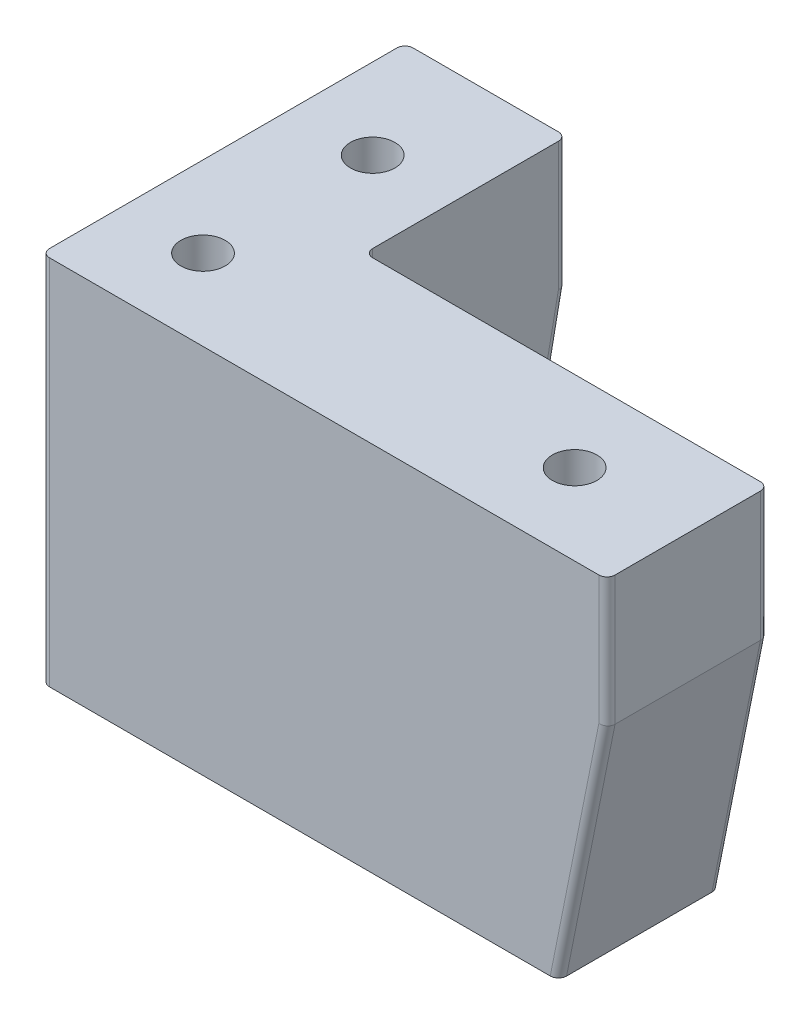
from build123d import *

# Parameters (mm, degrees)
BOSS_EXTRUDE1_DEPTH  = 16
SKETCH6_R            = 5.2
CUT_EXTRUDE2_DEPTH   = 41
M5_CLEARANCE_HOLE1_D = 5.5
FILLET2_R            = 1
SKETCH12_W           = 0.542735043
SKETCH12_H           = 2.03525641
BRF_PART_NUM_DEPTH   = 0.4


with BuildPart() as part:
    # Sketch1 → Boss-Extrude1 (new body)
    with BuildSketch(Plane(origin=(0, 0, 0), x_dir=(1, 0, 0), z_dir=(0, 1, 0))):
        Polygon((0, 0), (70, 0), (70, 20), (20, 20), (20, 45), (0, 45), align=None)
    extrude(amount=-BOSS_EXTRUDE1_DEPTH)

    # Sketch5 → section 1 of loft1
    with BuildSketch(Plane(origin=(0, -46, 0), x_dir=(1, 0, 0), z_dir=(0, 1, 0)), mode=Mode.PRIVATE) as loft1_s1:
        with BuildLine():
            Line((0, 0), (64, 0))
            Line((64, 0), (64, 20))
            Line((64, 20), (20, 20))
            Line((20, 20), (20, 39))
            Line((20, 39), (0, 39))
            Line((0, 39), (0, 0))
        make_face()
    # loft from a face of the part (loft1)
    loft([part.faces().sort_by_distance((28.421052632, -16, -15.921052632))[0], loft1_s1.sketch])

    # Sketch6 → Cut-Extrude2 (cut)
    with BuildSketch(Plane.XZ.offset(46)):
        with Locations(Location((56, -10, 0), (0, 0, 270))):
            Circle(SKETCH6_R)
        with Locations(Location((10, -10, 0), (0, 0, 270))):
            Circle(SKETCH6_R)
        with Locations(Location((10, -31, 0), (0, 0, 270))):
            Circle(SKETCH6_R)
    extrude(amount=-CUT_EXTRUDE2_DEPTH, mode=Mode.SUBTRACT)

    # M5 Clearance Hole1 (through all)
    with Locations(Plane(origin=(0, -5, 0), x_dir=(-1, 0, 0), z_dir=(0, -1, 0))):
        with Locations((-10, 10), (-56, 10), (-10, 31)):
            Hole(M5_CLEARANCE_HOLE1_D / 2)

    # Fillet2
    fillet2_edges = [part.edges().sort_by_distance(p)[0] for p in [
        (67, -31, 0),
        (67, -31, -20),
        (20, -23, -20),
        (20, -31, -42),
        (0, -31, -42),
        (0, -23, 0),
        (0, -8, -45),
        (20, -8, -45),
        (70, -8, -20),
        (70, -8, 0),
    ]]
    fillet(fillet2_edges, radius=FILLET2_R)

    # Sketch12 → BRF Part Num (cut)
    # profile 1 of 6: a face of its own
    with BuildSketch(Plane(origin=(0, -40, 0), x_dir=(0, -1, 0), z_dir=(1, 0, 0))):
        with BuildLine():
            Line((-37.291666667, 11.645299145), (-36.748931624, 11.645299145))
            Line((-36.748931624, 11.645299145), (-36.748931624, 13.445229033))
            Line((-36.748931624, 13.445229033), (-35.357113048, 13.730376936))
            add(Edge.make_bspline(
                [(-35.357113048, 13.730376936), (-35.372580244, 13.674351984), (-35.402545491, 13.565812498), (-35.435816121, 13.40561128), (-35.455872209, 13.253525448), (-35.458610738, 13.154835305), (-35.459935897, 13.107079661)],
                knots=[0, 0, 0, 0, 1.100273476, 2.13160584, 3.095893838, 4, 4, 4, 4], degree=3))
            add(Edge.make_bspline(
                [(-35.459935897, 13.107079661), (-35.458699161, 13.047977922), (-35.456267429, 12.931769136), (-35.431530908, 12.762005961), (-35.395702072, 12.599132488), (-35.340500968, 12.445553532), (-35.273090574, 12.298839318), (-35.188185711, 12.161509484), (-35.089059493, 12.031636602), (-34.97622244, 11.910118285), (-34.850748527, 11.800394824), (-34.715281067, 11.705048752), (-34.572776189, 11.621829319), (-34.41989387, 11.556925628), (-34.259517522, 11.503957886), (-34.08979586, 11.469030825), (-33.912235633, 11.445701061), (-33.790821361, 11.443099919), (-33.728907919, 11.441773504)],
                knots=[0, 0, 0, 0, 1.052805225, 2.070078116, 3.052532748, 4.020689046, 4.973125432, 5.925915817, 6.89216474, 7.881560752, 8.877013184, 9.857446635, 10.830895175, 11.812622661, 12.812548702, 13.836681939, 14.896847428, 16, 16, 16, 16], degree=3))
            add(Edge.make_bspline(
                [(-33.728907919, 11.441773504), (-33.685785308, 11.442779941), (-33.60012285, 11.444779212), (-33.472900882, 11.454923797), (-33.348390818, 11.474530771), (-33.226820927, 11.50053571), (-33.108077349, 11.53525102), (-32.991495245, 11.575856884), (-32.878351179, 11.626327286), (-32.768145441, 11.682279364), (-32.662139298, 11.744235746), (-32.562874439, 11.813904321), (-32.468085619, 11.886293984), (-32.380587921, 11.965393056), (-32.300041956, 12.050302222), (-32.226049525, 12.14054904), (-32.157282686, 12.235314957), (-32.096553125, 12.336092527), (-32.040668405, 12.440629054), (-31.994822172, 12.550436088), (-31.953833617, 12.663013552), (-31.921162075, 12.779981882), (-31.895561663, 12.901076097), (-31.878173851, 13.026495818), (-31.865509475, 13.155583259), (-31.864716697, 13.243084766), (-31.864316239, 13.287284655)],
                knots=[0, 0, 0, 0, 1.056393913, 2.098511576, 3.122979385, 4.141471433, 5.141222888, 6.151259816, 7.162667642, 8.172852865, 9.177685681, 10.166741883, 11.141342384, 12.097242845, 13.052202613, 14.005160326, 14.953864445, 15.917140761, 16.884916217, 17.854238259, 18.828761908, 19.81781811, 20.826036654, 21.857789401, 22.917898972, 24, 24, 24, 24], degree=3))
            add(Edge.make_bspline(
                [(-31.864316239, 13.287284655), (-31.86536353, 13.340009751), (-31.867423949, 13.443740147), (-31.888880904, 13.595736837), (-31.919815429, 13.741890122), (-31.965646605, 13.88157361), (-32.025659266, 14.014204742), (-32.096963386, 14.141682766), (-32.181849849, 14.262427648), (-32.279542228, 14.37561389), (-32.38688557, 14.479657137), (-32.502258635, 14.57400432), (-32.625808355, 14.656952914), (-32.757132984, 14.728803812), (-32.895999586, 14.790014228), (-33.042836041, 14.838120628), (-33.196900313, 14.876942439), (-33.302965578, 14.893367092), (-33.356837607, 14.901709402)],
                knots=[0, 0, 0, 0, 1.046872515, 2.059598001, 3.044168548, 4.012104806, 4.973680974, 5.932408326, 6.910122221, 7.900780896, 8.89867654, 9.876692837, 10.858029398, 11.85084981, 12.847361615, 13.868568023, 14.917415949, 16, 16, 16, 16], degree=3))
            Line((-33.356837607, 14.901709402), (-33.356837607, 14.426816239))
            add(Edge.make_bspline(
                [(-33.356837607, 14.426816239), (-33.306370336, 14.415138707), (-33.209369438, 14.392693841), (-33.073169351, 14.343299774), (-32.951755568, 14.283493409), (-32.844385746, 14.21071948), (-32.749094503, 14.12636518), (-32.665076427, 14.028307665), (-32.589185163, 13.918998341), (-32.525817449, 13.79746784), (-32.472438695, 13.669004222), (-32.434345863, 13.535316918), (-32.411287453, 13.39832995), (-32.408468654, 13.3060998), (-32.407051282, 13.259723892)],
                knots=[0, 0, 0, 0, 1.13623081, 2.183898708, 3.172478118, 4.09966615, 5.022692284, 5.957376522, 6.927682873, 7.937366477, 8.960015386, 9.976409503, 10.982481913, 12, 12, 12, 12], degree=3))
            add(Edge.make_bspline(
                [(-32.407051282, 13.259723892), (-32.408302603, 13.214433419), (-32.410766465, 13.125256108), (-32.429424138, 12.993950447), (-32.458913883, 12.867550289), (-32.500227327, 12.745831257), (-32.554882591, 12.629391456), (-32.622023433, 12.518395518), (-32.69997475, 12.411262209), (-32.789070259, 12.310811116), (-32.887309327, 12.218832512), (-32.992349634, 12.137557109), (-33.104408005, 12.069859012), (-33.221539833, 12.012808546), (-33.345030087, 11.96948751), (-33.474299706, 11.938582687), (-33.609668073, 11.920435207), (-33.701999052, 11.91793878), (-33.749048478, 11.916666667)],
                knots=[0, 0, 0, 0, 1.027268864, 2.022700798, 3.002744649, 3.968653148, 4.933396556, 5.915045722, 6.907600446, 7.935526002, 8.956456544, 9.95700807, 10.942805781, 11.92166854, 12.907987664, 13.905483474, 14.932689774, 16, 16, 16, 16], degree=3))
            add(Edge.make_bspline(
                [(-33.749048478, 11.916666667), (-33.791501358, 11.917631976), (-33.874246411, 11.919513463), (-33.995728944, 11.935801371), (-34.110858651, 11.963010064), (-34.22013648, 12.001749716), (-34.323213045, 12.050098039), (-34.419861193, 12.110800826), (-34.510989671, 12.181273297), (-34.594253359, 12.26354831), (-34.671222884, 12.353046493), (-34.736599449, 12.452066616), (-34.792196897, 12.55796521), (-34.837749179, 12.67093852), (-34.87403506, 12.791125705), (-34.899112726, 12.918591497), (-34.914118823, 13.053364947), (-34.916154476, 13.145554314), (-34.917200855, 13.192942041)],
                knots=[0, 0, 0, 0, 1.045723156, 2.038222538, 3.013889863, 3.95567481, 4.890389958, 5.81331128, 6.76251276, 7.723027653, 8.692928204, 9.666105983, 10.639751036, 11.635719707, 12.66315958, 13.728667616, 14.832476222, 16, 16, 16, 16], degree=3))
            add(Edge.make_bspline(
                [(-34.917200855, 13.192942041), (-34.916323056, 13.233958397), (-34.914510625, 13.318646768), (-34.901165802, 13.448553899), (-34.879637345, 13.585066385), (-34.850024804, 13.72766092), (-34.811273057, 13.876765735), (-34.764835658, 14.032066175), (-34.709315493, 14.193888768), (-34.667387027, 14.302923899), (-34.645833333, 14.358974359)],
                knots=[0, 0, 0, 0, 0.817624296, 1.688186739, 2.600797293, 3.572016777, 4.590301741, 5.671205678, 6.80286297, 8, 8, 8, 8], degree=3))
            Line((-34.645833333, 14.358974359), (-37.291666667, 13.816239316))
            Line((-37.291666667, 13.816239316), (-37.291666667, 11.645299145))
        make_face()
    # profile 2 of 6: a face of its own
    with BuildSketch(Plane(origin=(0, -40, 0), x_dir=(0, -1, 0), z_dir=(1, 0, 0))):
        with BuildLine():
            add(Edge.make_bspline(
                [(-34.643713275, 19.040064103), (-34.728527182, 19.03956817), (-34.89327942, 19.038604815), (-35.133346677, 19.027887797), (-35.358560447, 19.010084602), (-35.56893151, 18.98568643), (-35.764514182, 18.955995677), (-35.944785767, 18.916360347), (-36.110580689, 18.871286267), (-36.262439362, 18.81904613), (-36.40240851, 18.760100752), (-36.533073498, 18.695942621), (-36.654246443, 18.624034748), (-36.767826261, 18.548454517), (-36.872078268, 18.466259599), (-36.968203643, 18.379212409), (-37.055391743, 18.285571991), (-37.133702276, 18.186246573), (-37.202369187, 18.081909328), (-37.263225844, 17.975411402), (-37.313353149, 17.864849915), (-37.354358664, 17.751680348), (-37.387832412, 17.63566418), (-37.410825447, 17.51683103), (-37.425266903, 17.394905434), (-37.42664933, 17.312610771), (-37.427350427, 17.270875067)],
                knots=[0, 0, 0, 0, 1.646148282, 3.197666765, 4.66315463, 6.030252048, 7.307778049, 8.501004361, 9.610818041, 10.641065266, 11.615491391, 12.557119604, 13.464013759, 14.348536654, 15.203310953, 16.038349431, 16.863300206, 17.683791446, 18.490318933, 19.285717724, 20.06220424, 20.843281102, 21.620494212, 22.403315558, 23.190242141, 24, 24, 24, 24], degree=3))
            add(Edge.make_bspline(
                [(-37.427350427, 17.270875067), (-37.426766454, 17.228770065), (-37.425604553, 17.14499593), (-37.4092501, 17.021586479), (-37.388140934, 16.900326611), (-37.354285307, 16.783056077), (-37.313772659, 16.667557516), (-37.260316864, 16.556703146), (-37.202179536, 16.446579221), (-37.131256885, 16.342188524), (-37.052875685, 16.240412052), (-36.963892985, 16.145007235), (-36.866771391, 16.053535272), (-36.759344807, 15.969451023), (-36.6432604, 15.889150754), (-36.517545051, 15.815682744), (-36.38247736, 15.747518993), (-36.238683482, 15.683378202), (-36.08232246, 15.627288775), (-35.914369559, 15.57742079), (-35.733303883, 15.536545539), (-35.540134084, 15.502742425), (-35.333903201, 15.476504773), (-35.115029082, 15.457409454), (-34.883374796, 15.447319238), (-34.724990856, 15.445419387), (-34.643713275, 15.444444444)],
                knots=[0, 0, 0, 0, 0.810910589, 1.61342667, 2.396193133, 3.181089899, 3.963115317, 4.752255436, 5.550715454, 6.36105385, 7.181178335, 8.024612154, 8.872680183, 9.750181803, 10.651284446, 11.591556747, 12.554036451, 13.566402641, 14.62422919, 15.753422176, 16.94128843, 18.199818041, 19.531985927, 20.947085226, 22.433341622, 24, 24, 24, 24], degree=3))
            add(Edge.make_bspline(
                [(-34.643713275, 15.444444444), (-34.562790932, 15.445440836), (-34.404764101, 15.447386612), (-34.174141282, 15.457193047), (-33.956446942, 15.476971184), (-33.751448986, 15.501350226), (-33.55905237, 15.535531154), (-33.379382459, 15.576716347), (-33.21180314, 15.623640748), (-33.057515097, 15.680590997), (-32.913970745, 15.743238859), (-32.779896199, 15.811329465), (-32.654214049, 15.884382884), (-32.537823452, 15.963478835), (-32.43082806, 16.048946185), (-32.333373356, 16.140354033), (-32.243824688, 16.236591846), (-32.164579961, 16.338961657), (-32.093117341, 16.444324689), (-32.032870241, 16.554459802), (-31.980669665, 16.666548342), (-31.937990878, 16.781709405), (-31.904892981, 16.89976519), (-31.882139979, 17.02110817), (-31.866146366, 17.145013345), (-31.864928394, 17.22877589), (-31.864316239, 17.270875067)],
                knots=[0, 0, 0, 0, 1.561645053, 3.049612875, 4.452756685, 5.778837748, 7.032101753, 8.221335837, 9.334924186, 10.387562255, 11.392109817, 12.355697819, 13.287721948, 14.19548756, 15.068665045, 15.927346723, 16.771751757, 17.602390507, 18.423119567, 19.225778204, 20.022010933, 20.807278863, 21.593079439, 22.384715467, 23.188155646, 24, 24, 24, 24], degree=3))
            add(Edge.make_bspline(
                [(-31.864316239, 17.270875067), (-31.865021324, 17.312609858), (-31.866411614, 17.394902721), (-31.88079547, 17.516841507), (-31.903920815, 17.635197105), (-31.936300678, 17.750553559), (-31.975935026, 17.863502677), (-32.027572097, 17.972505464), (-32.087041637, 18.07877349), (-32.154767385, 18.1820248), (-32.232363413, 18.280313248), (-32.318175969, 18.374214704), (-32.414405575, 18.461283359), (-32.5195372, 18.542765573), (-32.633286004, 18.619144823), (-32.755728325, 18.690431317), (-32.887073233, 18.755934893), (-33.028148569, 18.815887343), (-33.181085066, 18.869041879), (-33.347302615, 18.915812681), (-33.528489491, 18.953167085), (-33.723725774, 18.984830716), (-33.933408166, 19.010203198), (-34.157612531, 19.027880405), (-34.395913121, 19.038596679), (-34.559605914, 19.039566035), (-34.643713275, 19.040064103)],
                knots=[0, 0, 0, 0, 0.810927267, 1.598990287, 2.382942141, 3.152806972, 3.926217614, 4.706701772, 5.493896336, 6.292070767, 7.104102563, 7.925577746, 8.761822141, 9.623241997, 10.509042271, 11.423174113, 12.375371989, 13.360203808, 14.400680605, 15.520553799, 16.714061498, 17.994519714, 19.364400916, 20.818312473, 22.365209998, 24, 24, 24, 24], degree=3))
        make_face()
        with BuildLine():
            add(Edge.make_bspline(
                [(-34.645833333, 18.56517094), (-34.575154036, 18.564986388), (-34.437979397, 18.564628207), (-34.238993342, 18.5555418), (-34.053087215, 18.542894446), (-33.880333573, 18.526983349), (-33.721336185, 18.503154217), (-33.575434041, 18.47611861), (-33.442897204, 18.44369105), (-33.322567459, 18.405134238), (-33.212740888, 18.361214277), (-33.110490223, 18.313345593), (-33.014603605, 18.261465332), (-32.925313667, 18.20451006), (-32.843711881, 18.141353732), (-32.767729828, 18.074924283), (-32.700010098, 18.002229104), (-32.618777326, 17.901686249), (-32.534839045, 17.768944231), (-32.46174395, 17.601697275), (-32.415808673, 17.429841243), (-32.409967028, 17.313195922), (-32.407051282, 17.254974626)],
                knots=[0, 0, 0, 0, 1.459098681, 2.831824031, 4.11146945, 5.306290378, 6.412266529, 7.42953815, 8.369053297, 9.227277979, 10.03601793, 10.809473603, 11.557037441, 12.285528272, 12.993193355, 13.685654407, 14.36688038, 15.041354379, 16.352855396, 17.594313975, 18.799247529, 20, 20, 20, 20], degree=3))
            add(Edge.make_bspline(
                [(-32.407051282, 17.254974626), (-32.409604366, 17.19641631), (-32.414701478, 17.079507395), (-32.459187058, 16.90780923), (-32.531506485, 16.742502876), (-32.614129716, 16.612044853), (-32.693318287, 16.513070126), (-32.760756315, 16.442130202), (-32.836289018, 16.377026127), (-32.917778456, 16.315276343), (-33.006788369, 16.258641915), (-33.102888837, 16.207141659), (-33.206347263, 16.160146608), (-33.278570555, 16.133372216), (-33.315496461, 16.11968316)],
                knots=[0, 0, 0, 0, 1.353621445, 2.702441307, 4.075953605, 5.516772412, 6.261413105, 7.007624062, 7.778524365, 8.566925914, 9.372323995, 10.217594641, 11.088702136, 12, 12, 12, 12], degree=3))
            add(Edge.make_bspline(
                [(-33.315496461, 16.11968316), (-33.362712853, 16.103729892), (-33.458582377, 16.071337916), (-33.607298851, 16.029591543), (-33.763331602, 15.99671457), (-33.925748147, 15.967136625), (-34.095746266, 15.946948076), (-34.272799966, 15.930698406), (-34.45704274, 15.92112701), (-34.582220881, 15.919940541), (-34.645833333, 15.919337607)],
                knots=[0, 0, 0, 0, 0.884706709, 1.796334032, 2.740027952, 3.714592787, 4.726048262, 5.777819803, 6.87074269, 8, 8, 8, 8], degree=3))
            add(Edge.make_bspline(
                [(-34.645833333, 15.919337607), (-34.709435497, 15.920169441), (-34.833854924, 15.921796685), (-35.016066935, 15.928016643), (-35.189131289, 15.944078475), (-35.35379355, 15.96191762), (-35.509142225, 15.988220558), (-35.656477793, 16.016580588), (-35.793975029, 16.054682379), (-35.92378639, 16.09538266), (-36.044437895, 16.141964542), (-36.156489101, 16.193243633), (-36.260491283, 16.24800143), (-36.356123103, 16.307504307), (-36.443939269, 16.370923449), (-36.521919136, 16.44053271), (-36.593855995, 16.511911388), (-36.674502526, 16.613426913), (-36.757380149, 16.745247911), (-36.831574439, 16.91040923), (-36.875484622, 17.081344076), (-36.881573992, 17.197139507), (-36.884615385, 17.254974626)],
                knots=[0, 0, 0, 0, 1.313483664, 2.569454835, 3.763100662, 4.901599063, 5.988328865, 7.015709358, 7.99797933, 8.932480776, 9.824041341, 10.666387587, 11.475829342, 12.24921787, 12.990555181, 13.709176526, 14.405678811, 15.080244297, 16.38186033, 17.610124501, 18.806354173, 20, 20, 20, 20], degree=3))
            add(Edge.make_bspline(
                [(-36.884615385, 17.254974626), (-36.881566425, 17.313510245), (-36.875462951, 17.430688121), (-36.83177751, 17.603448391), (-36.757597227, 17.769725475), (-36.674662199, 17.90198117), (-36.594165202, 18.002263452), (-36.52565299, 18.073426112), (-36.451485734, 18.140776846), (-36.369160047, 18.202297748), (-36.280184723, 18.258915291), (-36.185538085, 18.31280054), (-36.083096367, 18.360029094), (-35.973355914, 18.404090057), (-35.85301955, 18.44271118), (-35.720003149, 18.47476822), (-35.573752581, 18.503952364), (-35.413593467, 18.524969704), (-35.240802954, 18.543476868), (-35.054421404, 18.555402954), (-34.854752049, 18.564669832), (-34.716867691, 18.565000559), (-34.645833333, 18.56517094)],
                knots=[0, 0, 0, 0, 1.207546505, 2.417292871, 3.651582144, 4.952510111, 5.626719005, 6.30238548, 6.989136872, 7.692112372, 8.420316868, 9.164734959, 9.937886623, 10.746308695, 11.604196049, 12.543341915, 13.568754172, 14.680483261, 15.875568977, 17.154711427, 18.534182925, 20, 20, 20, 20], degree=3))
        make_face(mode=Mode.SUBTRACT)
    # profile 3 of 6: a face of its own
    with BuildSketch(Plane(origin=(0, -40, 0), x_dir=(0, -1, 0), z_dir=(1, 0, 0))):
        with Locations((-34.03525641, 20.46474359)):
            Rectangle(SKETCH12_W, SKETCH12_H)
    # profile 4 of 6: a face of its own
    with BuildSketch(Plane(origin=(0, -40, 0), x_dir=(0, -1, 0), z_dir=(1, 0, 0))):
        Polygon((-37.291666667, 24.53525641), (-37.291666667, 21.957264957), (-36.748931624, 21.957264957), (-36.748931624, 24.060363248), (-35.120726496, 24.060363248), (-35.120726496, 21.957264957), (-34.577991453, 21.957264957), (-34.577991453, 24.060363248), (-32, 24.060363248), (-32, 24.53525641), align=None)
    # profile 5 of 6: a face of its own
    with BuildSketch(Plane(origin=(0, -40, 0), x_dir=(0, -1, 0), z_dir=(1, 0, 0))):
        with BuildLine():
            Line((-37.291666667, 29.012820513), (-37.291666667, 27.953851162))
            add(Edge.make_bspline(
                [(-37.291666667, 27.953851162), (-37.291431435, 27.883183027), (-37.290979766, 27.74749238), (-37.288461291, 27.55310184), (-37.28124292, 27.376470396), (-37.275031133, 27.217690401), (-37.263704031, 27.076764768), (-37.252877814, 26.953261364), (-37.238705732, 26.847749012), (-37.225543962, 26.783877308), (-37.219584669, 26.754957933)],
                knots=[0, 0, 0, 0, 1.410062039, 2.707475311, 3.878576406, 4.937260626, 5.877586885, 6.699081471, 7.410979367, 8, 8, 8, 8], degree=3))
            add(Edge.make_bspline(
                [(-37.219584669, 26.754957933), (-37.210019176, 26.716243186), (-37.191092249, 26.639639583), (-37.151088227, 26.529345594), (-37.104792892, 26.424248168), (-37.050424199, 26.324774344), (-36.987548423, 26.231457523), (-36.917362949, 26.143204107), (-36.840009535, 26.060300571), (-36.754790866, 25.983828874), (-36.663522649, 25.914365722), (-36.566455374, 25.853435839), (-36.463990393, 25.801951208), (-36.355968109, 25.761548987), (-36.243581792, 25.727647085), (-36.12568437, 25.704869183), (-36.002669421, 25.690680776), (-35.918968364, 25.6892791), (-35.876527444, 25.688568376)],
                knots=[0, 0, 0, 0, 1.02737844, 2.032840108, 3.019645024, 3.985760442, 4.950801802, 5.916702504, 6.889791722, 7.870143693, 8.864820395, 9.842884691, 10.820524757, 11.815201459, 12.812418953, 13.84314332, 14.906358105, 16, 16, 16, 16], degree=3))
            add(Edge.make_bspline(
                [(-35.876527444, 25.688568376), (-35.806019607, 25.690789361), (-35.668440556, 25.695123079), (-35.46877708, 25.73552889), (-35.282526569, 25.801714819), (-35.109923533, 25.892917887), (-34.954332438, 26.009061618), (-34.817670678, 26.148647909), (-34.703310334, 26.311754631), (-34.624006689, 26.463594192), (-34.573217411, 26.597721613), (-34.537481487, 26.708141027), (-34.509871135, 26.828589909), (-34.485136174, 26.957914213), (-34.466461588, 27.096652121), (-34.452783999, 27.244471109), (-34.444235616, 27.4014766), (-34.442962585, 27.509334479), (-34.442307692, 27.564820379)],
                knots=[0, 0, 0, 0, 1.260483769, 2.459530307, 3.627416485, 4.787058657, 5.939039949, 7.08810263, 8.267026773, 9.491475466, 10.141966685, 10.831826277, 11.566392101, 12.351337768, 13.187381173, 14.07005841, 15.007169909, 16, 16, 16, 16], degree=3))
            Line((-34.442307692, 27.564820379), (-32, 25.620726496))
            Line((-32, 25.620726496), (-32, 26.207982772))
            Line((-32, 26.207982772), (-34.442307692, 28.152076656))
            Line((-34.442307692, 28.152076656), (-34.442307692, 28.53792735))
            Line((-34.442307692, 28.53792735), (-32, 28.53792735))
            Line((-32, 28.53792735), (-32, 29.012820513))
            Line((-32, 29.012820513), (-37.291666667, 29.012820513))
        make_face()
        with BuildLine():
            Line((-36.748931624, 28.53792735), (-34.985042735, 28.53792735))
            Line((-34.985042735, 28.53792735), (-34.977622529, 27.569060497))
            add(Edge.make_bspline(
                [(-34.977622529, 27.569060497), (-34.977602505, 27.523824242), (-34.977563693, 27.436143495), (-34.983602059, 27.30929376), (-34.990470588, 27.19118332), (-35.000979125, 27.082265469), (-35.014513976, 26.982486492), (-35.031470988, 26.891912825), (-35.051142008, 26.810342579), (-35.081903638, 26.715516182), (-35.128511472, 26.608375989), (-35.200901812, 26.494483668), (-35.28788413, 26.394552294), (-35.39021953, 26.313165611), (-35.500949552, 26.244976831), (-35.621208277, 26.199088494), (-35.747094629, 26.168505866), (-35.833588357, 26.165162367), (-35.877587473, 26.163461538)],
                knots=[0, 0, 0, 0, 1.146477201, 2.22219935, 3.21835465, 4.145220026, 4.995151787, 5.769831222, 6.480173269, 7.120302478, 8.295254187, 9.430763426, 10.528629691, 11.636497428, 12.733230534, 13.811001502, 14.886462612, 16, 16, 16, 16], degree=3))
            add(Edge.make_bspline(
                [(-35.877587473, 26.163461538), (-35.920138942, 26.165284277), (-36.004460427, 26.168896279), (-36.127967257, 26.19822406), (-36.244569168, 26.248362834), (-36.35441671, 26.314320614), (-36.45257154, 26.397097909), (-36.537466125, 26.492294284), (-36.606964031, 26.599891419), (-36.653154856, 26.699569807), (-36.680280691, 26.78937804), (-36.699996598, 26.866982653), (-36.713680172, 26.955099604), (-36.726641012, 27.053328162), (-36.737133161, 27.161855794), (-36.744370503, 27.281000581), (-36.748609016, 27.410024463), (-36.748821585, 27.499448585), (-36.748931624, 27.54573985)],
                knots=[0, 0, 0, 0, 1.100823979, 2.181431445, 3.263702604, 4.376021382, 5.48638238, 6.575013887, 7.666064109, 8.791843368, 9.405226397, 10.093019944, 10.863016055, 11.711746407, 12.658404307, 13.684961631, 14.801597923, 16, 16, 16, 16], degree=3))
            Line((-36.748931624, 27.54573985), (-36.748931624, 28.53792735))
        make_face(mode=Mode.SUBTRACT)
    # profile 6 of 6: a face of its own
    with BuildSketch(Plane(origin=(0, -40, 0), x_dir=(0, -1, 0), z_dir=(1, 0, 0))):
        with BuildLine():
            Line((-37.291666667, 33.219017094), (-37.291666667, 32.186548478))
            add(Edge.make_bspline(
                [(-37.291666667, 32.186548478), (-37.291405132, 32.136007005), (-37.290898213, 32.038045053), (-37.282853771, 31.895605062), (-37.272159447, 31.762143741), (-37.254220293, 31.637896931), (-37.235619757, 31.522056178), (-37.208318623, 31.415797507), (-37.178163526, 31.318230872), (-37.131765816, 31.201073313), (-37.059709589, 31.068142009), (-36.952843356, 30.925265731), (-36.824719372, 30.801068952), (-36.678711987, 30.695464876), (-36.518087317, 30.610715358), (-36.346301255, 30.550178488), (-36.166243896, 30.511287297), (-36.042797928, 30.507337862), (-35.980410323, 30.50534188)],
                knots=[0, 0, 0, 0, 1.00128172, 1.940733171, 2.826250472, 3.653024905, 4.427672124, 5.149348099, 5.824709082, 6.450061444, 7.643590664, 8.808605388, 9.972104426, 11.165284501, 12.367876273, 13.557044126, 14.765369432, 16, 16, 16, 16], degree=3))
            add(Edge.make_bspline(
                [(-35.980410323, 30.50534188), (-35.92197391, 30.507004387), (-35.807140846, 30.510271369), (-35.639473873, 30.541130813), (-35.480032383, 30.59010916), (-35.328952834, 30.657799211), (-35.189047585, 30.745014054), (-35.060750024, 30.849509696), (-34.948909094, 30.975060374), (-34.886407234, 31.069173586), (-34.854659121, 31.116978833)],
                knots=[0, 0, 0, 0, 1.044641374, 2.052818814, 3.038628718, 4.023282556, 5.005660861, 5.98021751, 6.974042014, 8, 8, 8, 8], degree=3))
            add(Edge.make_bspline(
                [(-34.854659121, 31.116978833), (-34.831572423, 31.056870658), (-34.787401852, 30.941868829), (-34.709430902, 30.78351824), (-34.624318158, 30.647586683), (-34.532806756, 30.531418802), (-34.432712419, 30.432590006), (-34.323221924, 30.346998554), (-34.20442491, 30.273003075), (-34.07675799, 30.210033435), (-33.941303457, 30.160569998), (-33.799715753, 30.124215057), (-33.652537655, 30.102710319), (-33.552659651, 30.099776743), (-33.502061632, 30.098290598)],
                knots=[0, 0, 0, 0, 1.272586185, 2.434772614, 3.483318042, 4.437947805, 5.351807173, 6.25737843, 7.180033415, 8.1141739, 9.066731021, 10.025721652, 10.999834114, 12, 12, 12, 12], degree=3))
            add(Edge.make_bspline(
                [(-33.502061632, 30.098290598), (-33.450404365, 30.099767174), (-33.348767245, 30.102672377), (-33.19946189, 30.124115755), (-33.056764924, 30.160398292), (-32.919819116, 30.210461063), (-32.788911594, 30.275350747), (-32.664516592, 30.355460695), (-32.546375308, 30.449666322), (-32.434279237, 30.556133909), (-32.331707807, 30.674783705), (-32.243530969, 30.805543418), (-32.167711455, 30.944830866), (-32.10598191, 31.094426709), (-32.058357608, 31.253949059), (-32.025176568, 31.423309149), (-32.002781719, 31.602228068), (-32.000942973, 31.725010376), (-32, 31.787977431)],
                knots=[0, 0, 0, 0, 0.978680899, 1.925582087, 2.851223405, 3.764209995, 4.683484765, 5.614004905, 6.562443559, 7.542772147, 8.539900013, 9.527881485, 10.525548727, 11.540192123, 12.58875426, 13.674701727, 14.807505862, 16, 16, 16, 16], degree=3))
            Line((-32, 31.787977431), (-32, 33.219017094))
            Line((-32, 33.219017094), (-37.291666667, 33.219017094))
        make_face()
        with BuildLine():
            Line((-36.748931624, 32.744123932), (-35.052884615, 32.744123932))
            Line((-35.052884615, 32.744123932), (-35.052884615, 32.425055088))
            add(Edge.make_bspline(
                [(-35.052884615, 32.425055088), (-35.053489261, 32.378414647), (-35.054657559, 32.288295811), (-35.058004187, 32.15778835), (-35.067375034, 32.036646949), (-35.076743206, 31.92508074), (-35.09197498, 31.823265328), (-35.110106069, 31.73142656), (-35.129280956, 31.648122196), (-35.161893899, 31.552058703), (-35.210076793, 31.44307601), (-35.284925308, 31.326971957), (-35.374004491, 31.224141545), (-35.47775097, 31.138348354), (-35.590749128, 31.067513266), (-35.712006948, 31.01789106), (-35.839084272, 30.984809412), (-35.926491474, 30.981775452), (-35.970870059, 30.980235043)],
                knots=[0, 0, 0, 0, 1.156917035, 2.235399477, 3.236897345, 4.169954739, 5.01148057, 5.788325709, 6.491867502, 7.129259015, 8.302032419, 9.437271567, 10.542795419, 11.662606952, 12.764338259, 13.836858145, 14.901724648, 16, 16, 16, 16], degree=3))
            add(Edge.make_bspline(
                [(-35.970870059, 30.980235043), (-36.000243825, 30.981017168), (-36.057863676, 30.982551391), (-36.142133004, 30.99557316), (-36.221315262, 31.016671882), (-36.296170402, 31.045245239), (-36.364838095, 31.084280684), (-36.430599459, 31.129527894), (-36.48951571, 31.185391999), (-36.544423308, 31.248523397), (-36.593565423, 31.320756977), (-36.63427205, 31.403649012), (-36.671165779, 31.495056617), (-36.698477109, 31.59745973), (-36.722493142, 31.708736523), (-36.737582577, 31.830393726), (-36.747292771, 31.961660422), (-36.748373155, 32.052611755), (-36.748931624, 32.099626068)],
                knots=[0, 0, 0, 0, 0.911708768, 1.788416306, 2.640049961, 3.452993646, 4.268229297, 5.087074648, 5.92553149, 6.781184137, 7.681934069, 8.628939405, 9.643570426, 10.73771997, 11.914765019, 13.176320755, 14.540391495, 16, 16, 16, 16], degree=3))
            Line((-36.748931624, 32.099626068), (-36.748931624, 32.744123932))
        make_face(mode=Mode.SUBTRACT)
        with BuildLine():
            Line((-34.510149573, 32.744123932), (-32.542735043, 32.744123932))
            Line((-32.542735043, 32.744123932), (-32.542735043, 32.067825187))
            add(Edge.make_bspline(
                [(-32.542735043, 32.067825187), (-32.543372923, 32.019420683), (-32.544602352, 31.926127384), (-32.547485619, 31.791321812), (-32.558392582, 31.666703931), (-32.568454207, 31.551880615), (-32.585659152, 31.447156608), (-32.601896146, 31.351726364), (-32.625998805, 31.267156439), (-32.659125074, 31.16819006), (-32.712156119, 31.057568523), (-32.789633974, 30.936679095), (-32.885253608, 30.831265388), (-32.994002833, 30.740777561), (-33.111920178, 30.666103076), (-33.237464101, 30.612517069), (-33.368193009, 30.579216814), (-33.457348927, 30.575198827), (-33.502061632, 30.573183761)],
                knots=[0, 0, 0, 0, 1.160376723, 2.23647316, 3.230273494, 4.158083346, 4.997711197, 5.773399541, 6.476071462, 7.102777513, 8.27340052, 9.405620712, 10.53304798, 11.669441455, 12.787990954, 13.865552736, 14.929550474, 16, 16, 16, 16], degree=3))
            add(Edge.make_bspline(
                [(-33.502061632, 30.573183761), (-33.530022404, 30.573599926), (-33.585492938, 30.574425543), (-33.666999742, 30.586933444), (-33.745992725, 30.605028412), (-33.822801062, 30.628860007), (-33.896133323, 30.66217529), (-33.966270738, 30.703017036), (-34.034626202, 30.749767671), (-34.122161294, 30.821895057), (-34.221764088, 30.928336679), (-34.31807681, 31.079602102), (-34.397004154, 31.250646595), (-34.430371256, 31.374993412), (-34.447607839, 31.439227764)],
                knots=[0, 0, 0, 0, 0.723302347, 1.434937762, 2.129609326, 2.821140842, 3.513216847, 4.209993937, 4.920569932, 5.655069131, 7.14393391, 8.6716197, 10.280644748, 12, 12, 12, 12], degree=3))
            add(Edge.make_bspline(
                [(-34.447607839, 31.439227764), (-34.452831597, 31.464974136), (-34.464157782, 31.520797579), (-34.476113476, 31.611825706), (-34.486764936, 31.715747794), (-34.49464371, 31.832803811), (-34.502787651, 31.963141856), (-34.505954821, 32.107040293), (-34.509733464, 32.263911471), (-34.510007322, 32.372757081), (-34.510149573, 32.429295206)],
                knots=[0, 0, 0, 0, 0.634451884, 1.375622551, 2.216452059, 3.157844607, 4.20941857, 5.370758133, 6.634282058, 8, 8, 8, 8], degree=3))
            Line((-34.510149573, 32.429295206), (-34.510149573, 32.744123932))
        make_face(mode=Mode.SUBTRACT)
    extrude(amount=BRF_PART_NUM_DEPTH, mode=Mode.SUBTRACT)


solid = part.part
